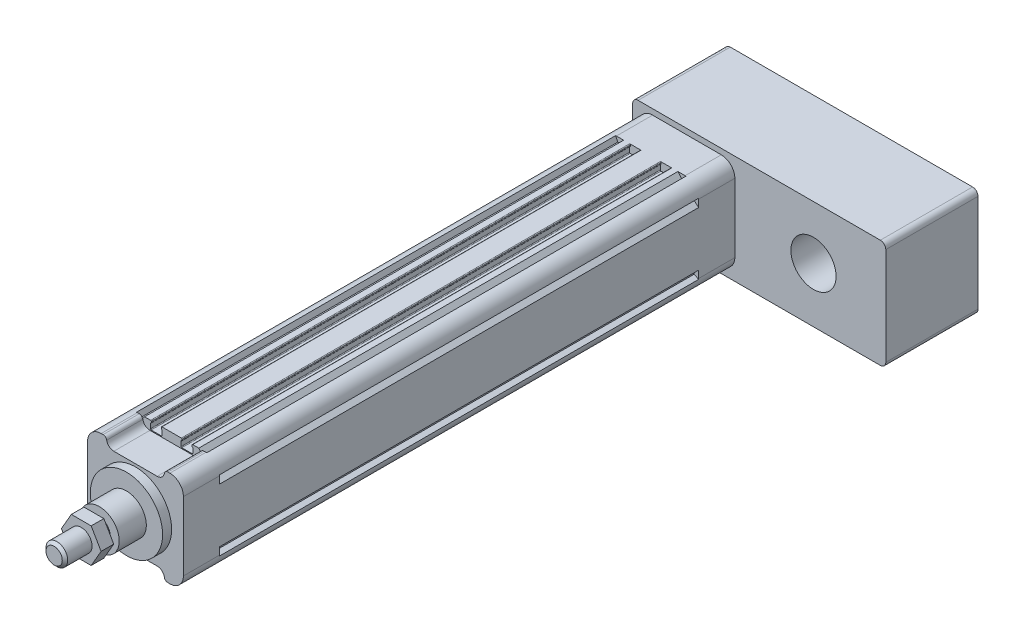
from build123d import *

# Parameters (mm, degrees)
SKETCH_1_R                  = 2.1
EXTRUDE_1_DEPTH             = 265
EXTRUDE_2_DEPTH             = 20
SKETCH_7_R                  = 20
EXTRUDE_3_DEPTH             = 5
SKETCH_9_R                  = 11
EXTRUDE_4_DEPTH             = 15
SKETCH_10_R                 = 6
EXTRUDE_5_DEPTH             = 25
EXTRUDE_START               = 20
EXTRUDE_6_DEPTH             = 20
EXTRUDE_7_DEPTH             = 51
SKETCH_13_R                 = 12.5
CUT_EXTRUDE_2_DEPTH         = 30
PATTERN_LINEAR_1_COUNT      = 2
PATTERN_LINEAR_1_PITCH      = 38
PATTERN_LINEAR_1_COUNT_DIR2 = 2
PATTERN_LINEAR_1_PITCH_DIR2 = 38
HOLE_WIZARD_M6_2_D          = 5
HOLE_WIZARD_M6_2_DEPTH      = 15
HOLE_WIZARD_M6_2_TIP        = 1.502151548
HOLE_WIZARD_M6_3_D          = 5
HOLE_WIZARD_M6_3_DEPTH      = 15
HOLE_WIZARD_M6_3_TIP        = 1.502151548
HOLE_WIZARD_M6_4_D          = 5
HOLE_WIZARD_M6_4_DEPTH      = 15
HOLE_WIZARD_M6_4_TIP        = 1.502151548
CHAMFER_1_SIZE              = 1.5
EXTRUDE_START_2             = 3
EXTRUDE_8_DEPTH             = 7


with BuildPart() as part:
    # 草图1 → 凸台-拉伸1 (new body)
    with BuildSketch(Plane.XY):
        with BuildLine():
            Line((-18.2, 24), (-19.443439638, 26.486879276))
            ThreePointArc((-19.443439638, 26.486879276), (-24.303300859, 24.303300859), (-26.486879276, 19.443439638))
            Line((-26.486879276, 19.443439638), (-24, 18.2))
            Line((-24, 18.2), (-24, 17.1))
            Line((-24, 17.1), (-26.5, 15))
            Line((-26.5, 15), (-26.5, -15))
            Line((-26.5, -15), (-24, -17.1))
            Line((-24, -17.1), (-24, -18.2))
            Line((-24, -18.2), (-26.486879276, -19.443439638))
            ThreePointArc((-26.486879276, -19.443439638), (-24.303300859, -24.303300859), (-19.443439638, -26.486879276))
            Line((-19.443439638, -26.486879276), (-18.2, -24))
            Line((-18.2, -24), (-17.1, -24))
            Line((-17.1, -24), (-15, -26.5))
            Line((-15, -26.5), (-11.65, -26.5))
            ThreePointArc((-11.65, -26.5), (-11.367157288, -26.382842712), (-11.25, -26.1))
            Line((-11.25, -26.1), (-11.25, -25.6))
            ThreePointArc((-11.25, -25.6), (-11.367157288, -25.317157288), (-11.65, -25.2))
            Line((-11.65, -25.2), (-11.75, -25.2))
            Line((-11.75, -25.2), (-11.75, -22.4))
            ThreePointArc((-11.75, -22.4), (-11.632842712, -22.117157288), (-11.35, -22))
            Line((-11.35, -22), (-5.65, -22))
            ThreePointArc((-5.65, -22), (-5.367157288, -22.117157288), (-5.25, -22.4))
            Line((-5.25, -22.4), (-5.25, -25.2))
            Line((-5.25, -25.2), (-5.35, -25.2))
            ThreePointArc((-5.35, -25.2), (-5.632842712, -25.317157288), (-5.75, -25.6))
            Line((-5.75, -25.6), (-5.75, -26.1))
            ThreePointArc((-5.75, -26.1), (-5.632842712, -26.382842712), (-5.35, -26.5))
            Line((-5.35, -26.5), (5.35, -26.5))
            ThreePointArc((5.35, -26.5), (5.632842712, -26.382842712), (5.75, -26.1))
            Line((5.75, -26.1), (5.75, -25.6))
            ThreePointArc((5.75, -25.6), (5.632842712, -25.317157288), (5.35, -25.2))
            Line((5.35, -25.2), (5.25, -25.2))
            Line((5.25, -25.2), (5.25, -22.4))
            ThreePointArc((5.25, -22.4), (5.367157288, -22.117157288), (5.65, -22))
            Line((5.65, -22), (11.35, -22))
            ThreePointArc((11.35, -22), (11.632842712, -22.117157288), (11.75, -22.4))
            Line((11.75, -22.4), (11.75, -25.2))
            Line((11.75, -25.2), (11.65, -25.2))
            ThreePointArc((11.65, -25.2), (11.367157288, -25.317157288), (11.25, -25.6))
            Line((11.25, -25.6), (11.25, -26.1))
            ThreePointArc((11.25, -26.1), (11.367157288, -26.382842712), (11.65, -26.5))
            Line((11.65, -26.5), (15, -26.5))
            Line((15, -26.5), (17.1, -24))
            Line((17.1, -24), (18.2, -24))
            Line((18.2, -24), (19.443439638, -26.486879276))
            ThreePointArc((19.443439638, -26.486879276), (24.303300859, -24.303300859), (26.486879276, -19.443439638))
            Line((26.486879276, -19.443439638), (24, -18.2))
            Line((24, -18.2), (24, -17.1))
            Line((24, -17.1), (26.5, -15))
            Line((26.5, -15), (26.5, 15))
            Line((26.5, 15), (24, 17.1))
            Line((24, 17.1), (24, 18.2))
            Line((24, 18.2), (26.486879276, 19.443439638))
            ThreePointArc((26.486879276, 19.443439638), (24.303300859, 24.303300859), (19.443439638, 26.486879276))
            Line((19.443439638, 26.486879276), (18.2, 24))
            Line((18.2, 24), (17.1, 24))
            Line((17.1, 24), (15, 26.5))
            Line((15, 26.5), (11.65, 26.5))
            ThreePointArc((11.65, 26.5), (11.367157288, 26.382842712), (11.25, 26.1))
            Line((11.25, 26.1), (11.25, 25.6))
            ThreePointArc((11.25, 25.6), (11.367157288, 25.317157288), (11.65, 25.2))
            Line((11.65, 25.2), (11.75, 25.2))
            Line((11.75, 25.2), (11.75, 22.4))
            ThreePointArc((11.75, 22.4), (11.632842712, 22.117157288), (11.35, 22))
            Line((11.35, 22), (5.65, 22))
            ThreePointArc((5.65, 22), (5.367157288, 22.117157288), (5.25, 22.4))
            Line((5.25, 22.4), (5.25, 25.2))
            Line((5.25, 25.2), (5.35, 25.2))
            ThreePointArc((5.35, 25.2), (5.632842712, 25.317157288), (5.75, 25.6))
            Line((5.75, 25.6), (5.75, 26.1))
            ThreePointArc((5.75, 26.1), (5.632842712, 26.382842712), (5.35, 26.5))
            Line((5.35, 26.5), (-5.35, 26.5))
            ThreePointArc((-5.35, 26.5), (-5.632842712, 26.382842712), (-5.75, 26.1))
            Line((-5.75, 26.1), (-5.75, 25.6))
            ThreePointArc((-5.75, 25.6), (-5.632842712, 25.317157288), (-5.35, 25.2))
            Line((-5.35, 25.2), (-5.25, 25.2))
            Line((-5.25, 25.2), (-5.25, 22.4))
            ThreePointArc((-5.25, 22.4), (-5.367157288, 22.117157288), (-5.65, 22))
            Line((-5.65, 22), (-11.35, 22))
            ThreePointArc((-11.35, 22), (-11.632842712, 22.117157288), (-11.75, 22.4))
            Line((-11.75, 22.4), (-11.75, 25.2))
            Line((-11.75, 25.2), (-11.65, 25.2))
            ThreePointArc((-11.65, 25.2), (-11.367157288, 25.317157288), (-11.25, 25.6))
            Line((-11.25, 25.6), (-11.25, 26.1))
            ThreePointArc((-11.25, 26.1), (-11.367157288, 26.382842712), (-11.65, 26.5))
            Line((-11.65, 26.5), (-15, 26.5))
            Line((-15, 26.5), (-17.1, 24))
            Line((-17.1, 24), (-18.2, 24))
        make_face()
        with Locations((19, 19)):
            Circle(SKETCH_1_R, mode=Mode.SUBTRACT)
        with Locations((19, -19)):
            Circle(SKETCH_1_R, mode=Mode.SUBTRACT)
        with Locations((-19, -19)):
            Circle(SKETCH_1_R, mode=Mode.SUBTRACT)
        with Locations((-19, 19)):
            Circle(SKETCH_1_R, mode=Mode.SUBTRACT)
        with BuildLine():
            Line((19.773719933, 3), (23.3, 3))
            Line((23.3, 3), (23.3, -3))
            Line((23.3, -3), (19.773719933, -3))
            ThreePointArc((19.773719933, -3), (0, -20), (-19.773719933, -3))
            Line((-19.773719933, -3), (-23.3, -3))
            Line((-23.3, -3), (-23.3, 3))
            Line((-23.3, 3), (-19.773719933, 3))
            ThreePointArc((-19.773719933, 3), (0, 20), (19.773719933, 3))
        make_face(mode=Mode.SUBTRACT)
    extrude(amount=EXTRUDE_1_DEPTH)

    # 草图6 → 凸台-拉伸2 (add)
    with BuildSketch(Plane.XY.offset(265)):
        with BuildLine():
            Line((-26.5, -19), (-26.5, 19))
            ThreePointArc((-26.5, 19), (-24.303300859, 24.303300859), (-19, 26.5))
            Line((-19, 26.5), (-17.916079783, 26.5))
            ThreePointArc((-17.916079783, 26.5), (-16.625085334, 26.027525232), (-15.944053189, 24.833333333))
            ThreePointArc((-15.944053189, 24.833333333), (-14.581988897, 22.444949537), (-12, 21.5))
            Line((-12, 21.5), (12, 21.5))
            ThreePointArc((12, 21.5), (14.581988897, 22.444949537), (15.944053189, 24.833333333))
            ThreePointArc((15.944053189, 24.833333333), (16.625085334, 26.027525232), (17.916079783, 26.5))
            Line((17.916079783, 26.5), (19, 26.5))
            ThreePointArc((19, 26.5), (24.303300859, 24.303300859), (26.5, 19))
            Line((26.5, 19), (26.5, -19))
            ThreePointArc((26.5, -19), (24.303300859, -24.303300859), (19, -26.5))
            Line((19, -26.5), (17.916079783, -26.5))
            ThreePointArc((17.916079783, -26.5), (16.625085334, -26.027525232), (15.944053189, -24.833333333))
            ThreePointArc((15.944053189, -24.833333333), (14.581988897, -22.444949537), (12, -21.5))
            Line((12, -21.5), (-12, -21.5))
            ThreePointArc((-12, -21.5), (-14.581988897, -22.444949537), (-15.944053189, -24.833333333))
            ThreePointArc((-15.944053189, -24.833333333), (-16.625085334, -26.027525232), (-17.916079783, -26.5))
            Line((-17.916079783, -26.5), (-19, -26.5))
            ThreePointArc((-19, -26.5), (-24.303300859, -24.303300859), (-26.5, -19))
        make_face()
    extrude(amount=EXTRUDE_2_DEPTH)

    # 草图7 → 凸台-拉伸3 (add)
    with BuildSketch(Plane.XY.offset(285)):
        Circle(SKETCH_7_R)
    extrude(amount=EXTRUDE_3_DEPTH)

    # 草图9 → 凸台-拉伸4 (add)
    with BuildSketch(Plane.XY.offset(290)):
        Circle(SKETCH_9_R)
    extrude(amount=EXTRUDE_4_DEPTH)

    # 草图10 → 凸台-拉伸5 (add)
    with BuildSketch(Plane.XY.offset(305)):
        Circle(SKETCH_10_R)
    extrude(amount=EXTRUDE_5_DEPTH)

    # 草图11 → 凸台-拉伸6 (add)
    with BuildSketch(Plane(origin=(0, 0, 0), x_dir=(-1, 0, 0), z_dir=(0, 0, -1)).offset(EXTRUDE_START)):
        with BuildLine():
            Line((-19, -26.5), (19, -26.5))
            ThreePointArc((19, -26.5), (24.303300859, -24.303300859), (26.5, -19))
            Line((26.5, -19), (26.5, 19))
            ThreePointArc((26.5, 19), (24.303300859, 24.303300859), (19, 26.5))
            Line((19, 26.5), (-19, 26.5))
            ThreePointArc((-19, 26.5), (-24.303300859, 24.303300859), (-26.5, 19))
            Line((-26.5, 19), (-26.5, -19))
            ThreePointArc((-26.5, -19), (-24.303300859, -24.303300859), (-19, -26.5))
        make_face()
    extrude(amount=-EXTRUDE_6_DEPTH)

    # 草图12 → 凸台-拉伸7 (add)
    with BuildSketch(Plane(origin=(0, 0, -20), x_dir=(-1, 0, 0), z_dir=(0, 0, -1))):
        with BuildLine():
            Line((-107, -30.404162038), (27, -30.404162038))
            ThreePointArc((27, -30.404162038), (29.121320344, -29.525482382), (30, -27.404162038))
            Line((30, -27.404162038), (30, 26.595837962))
            ThreePointArc((30, 26.595837962), (29.121320344, 28.717158305), (27, 29.595837962))
            Line((27, 29.595837962), (-107, 29.595837962))
            ThreePointArc((-107, 29.595837962), (-109.121320344, 28.717158305), (-110, 26.595837962))
            Line((-110, 26.595837962), (-110, -27.404162038))
            ThreePointArc((-110, -27.404162038), (-109.121320344, -29.525482382), (-107, -30.404162038))
        make_face()
    extrude(amount=EXTRUDE_7_DEPTH)

    # 草图13 → 切除-拉伸2 (cut)
    with BuildSketch(Plane.XY.offset(-20)):
        with Locations((70, 0)):
            Circle(SKETCH_13_R)
    extrude(amount=-CUT_EXTRUDE_2_DEPTH, mode=Mode.SUBTRACT)

    # 草图15 → M6 螺纹孔1 (revolve, cut)
    with BuildSketch(Plane(origin=(-19, -19, -71), x_dir=(0, 1, 0), z_dir=(1, 0, 0))):
        Polygon((0, 0), (0, 16.502151548), (2.5, 15), (2.5, 0), align=None)
    hole_wizard_m6_1 = revolve(axis=Axis((-19, -19, -77.35), (0, 0, 1)), mode=Mode.SUBTRACT)

    # 阵列(线性)1: Hole Wizard M6 _1 2 × 2
    with Locations(*[(j * PATTERN_LINEAR_1_PITCH_DIR2, i * PATTERN_LINEAR_1_PITCH, 0) for i in range(PATTERN_LINEAR_1_COUNT) for j in range(PATTERN_LINEAR_1_COUNT_DIR2) if (i, j) != (0, 0)]):
        add(hole_wizard_m6_1, mode=Mode.SUBTRACT)

    # M6 螺纹孔2
    with Locations(Plane(origin=(0, 0, -71), x_dir=(-1, 0, 0), z_dir=(0, 0, -1))):
        with Locations((-84, -19), (-84, 19)):
            Hole(HOLE_WIZARD_M6_2_D / 2, depth=HOLE_WIZARD_M6_2_DEPTH)
            with Locations((0, 0, -(HOLE_WIZARD_M6_2_DEPTH + HOLE_WIZARD_M6_2_TIP / 2))):  # 118° drill point
                Cone(0, HOLE_WIZARD_M6_2_D / 2, HOLE_WIZARD_M6_2_TIP, mode=Mode.SUBTRACT)

    # M6 螺纹孔3
    with Locations(Plane.ZY.offset(26.5)):
        with Locations((275, 11), (275, -11)):
            Hole(HOLE_WIZARD_M6_3_D / 2, depth=HOLE_WIZARD_M6_3_DEPTH)
            with Locations((0, 0, -(HOLE_WIZARD_M6_3_DEPTH + HOLE_WIZARD_M6_3_TIP / 2))):  # 118° drill point
                Cone(0, HOLE_WIZARD_M6_3_D / 2, HOLE_WIZARD_M6_3_TIP, mode=Mode.SUBTRACT)

    # M6 螺纹孔4
    with Locations(Plane.ZY.offset(26.5)):
        with Locations((-10, 11), (-10, -11)):
            Hole(HOLE_WIZARD_M6_4_D / 2, depth=HOLE_WIZARD_M6_4_DEPTH)
            with Locations((0, 0, -(HOLE_WIZARD_M6_4_DEPTH + HOLE_WIZARD_M6_4_TIP / 2))):  # 118° drill point
                Cone(0, HOLE_WIZARD_M6_4_D / 2, HOLE_WIZARD_M6_4_TIP, mode=Mode.SUBTRACT)

    # 倒角1
    chamfer_1_edges = [part.edges().sort_by_distance(p)[0] for p in [
        (-6, 0, 330),
    ]]
    chamfer(chamfer_1_edges, length=CHAMFER_1_SIZE)

    # 草图23 → 凸台-拉伸8 (add)
    with BuildSketch(Plane.XY.offset(305).offset(EXTRUDE_START_2)):
        Polygon((10.969655115, 0), (5.484827557, 9.5), (-5.484827557, 9.5), (-10.969655115, 0), (-5.484827557, -9.5), (5.484827557, -9.5), align=None)
    extrude(amount=EXTRUDE_8_DEPTH)


solid = part.part
